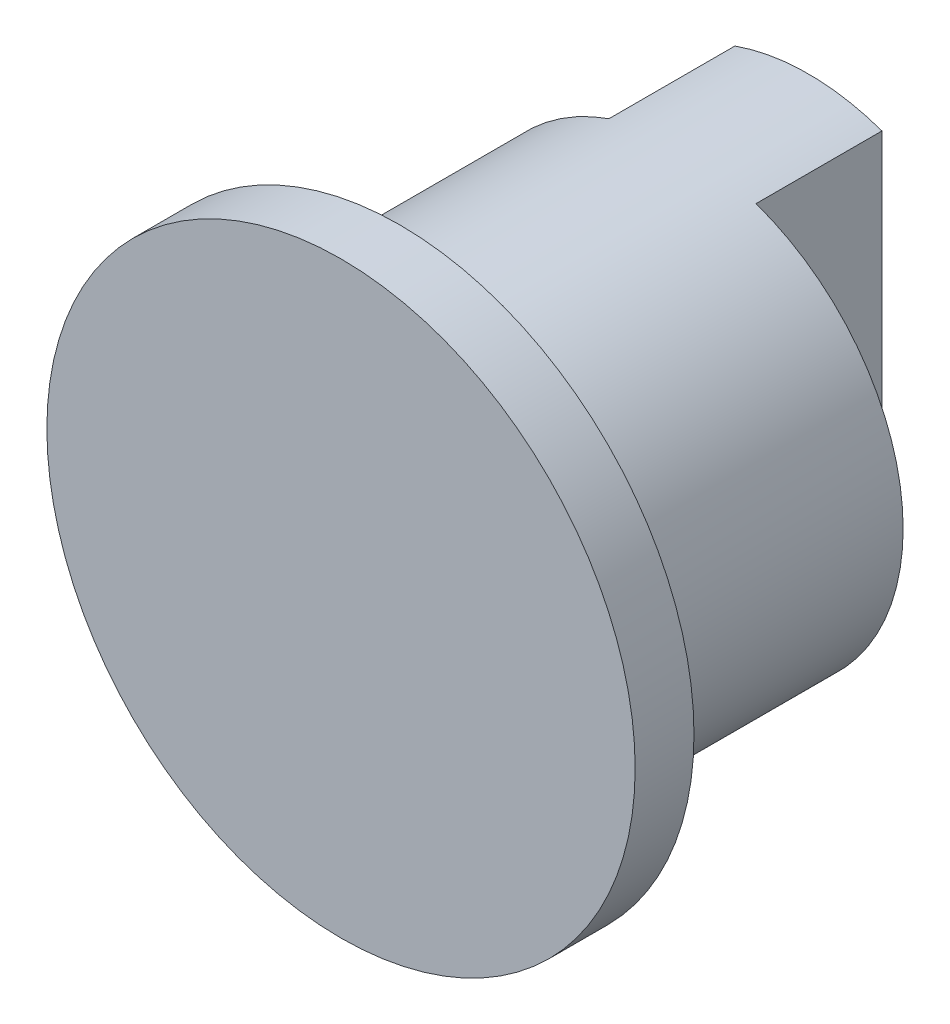
from build123d import *

# Parameters (mm, degrees)
SKETCH1_R                 = 4.7625
BOSS_EXTRUDE1_DEPTH       = 10.09015
CUT_EXTRUDE1_DEPTH        = 13.49375
CUT_EXTRUDE1_DEPTH_BACK   = 13.49375
SKETCH2_W                 = 3.175
SKETCH2_H                 = 3.175
SKETCH2_W_2               = 0.335237521
SKETCH2_H_2               = 0.139682301
F_4_40_TAPPED_HOLE1_D     = 2.2606
F_4_40_TAPPED_HOLE1_DEPTH = 8.8646
F_4_40_TAPPED_HOLE1_TIP   = 0.679152758
SKETCH6_R                 = 6.35
BOSS_EXTRUDE2_DEPTH       = 1.27


with BuildPart() as part:
    # Sketch1 → Boss-Extrude1 (new body)
    with BuildSketch(Plane.XY):
        Circle(SKETCH1_R)
    extrude(amount=BOSS_EXTRUDE1_DEPTH)

    # Sketch2 → Cut-Extrude1 (cut, two sides: drawn at the far end of the back side and taken through both)
    with BuildSketch(Plane(origin=(0, 0, 0), x_dir=(1, 0, 0), z_dir=(0, 1, 0)).offset(-CUT_EXTRUDE1_DEPTH_BACK)):
        with Locations((-3.175, -1.1303)):
            Rectangle(SKETCH2_W, SKETCH2_H)
        with Locations((6.06221185, 0.404858795)):
            Rectangle(SKETCH2_W_2, SKETCH2_H_2)
        with Locations((3.175, -1.1303)):
            Rectangle(SKETCH2_W, SKETCH2_H)
    extrude(amount=CUT_EXTRUDE1_DEPTH + CUT_EXTRUDE1_DEPTH_BACK, mode=Mode.SUBTRACT)

    # #4-40 Tapped Hole1
    with Locations(Plane(origin=(0, 0, 0), x_dir=(-1, 0, 0), z_dir=(0, 0, -1))):
        with Locations((0, 0)):
            Hole(F_4_40_TAPPED_HOLE1_D / 2, depth=F_4_40_TAPPED_HOLE1_DEPTH)
            with Locations((0, 0, -(F_4_40_TAPPED_HOLE1_DEPTH + F_4_40_TAPPED_HOLE1_TIP / 2))):  # 118° drill point
                Cone(0, F_4_40_TAPPED_HOLE1_D / 2, F_4_40_TAPPED_HOLE1_TIP, mode=Mode.SUBTRACT)

    # Sketch6 → Boss-Extrude2 (add)
    with BuildSketch(Plane.XY.offset(10.09015)):
        Circle(SKETCH6_R)
    extrude(amount=-BOSS_EXTRUDE2_DEPTH)


solid = part.part
